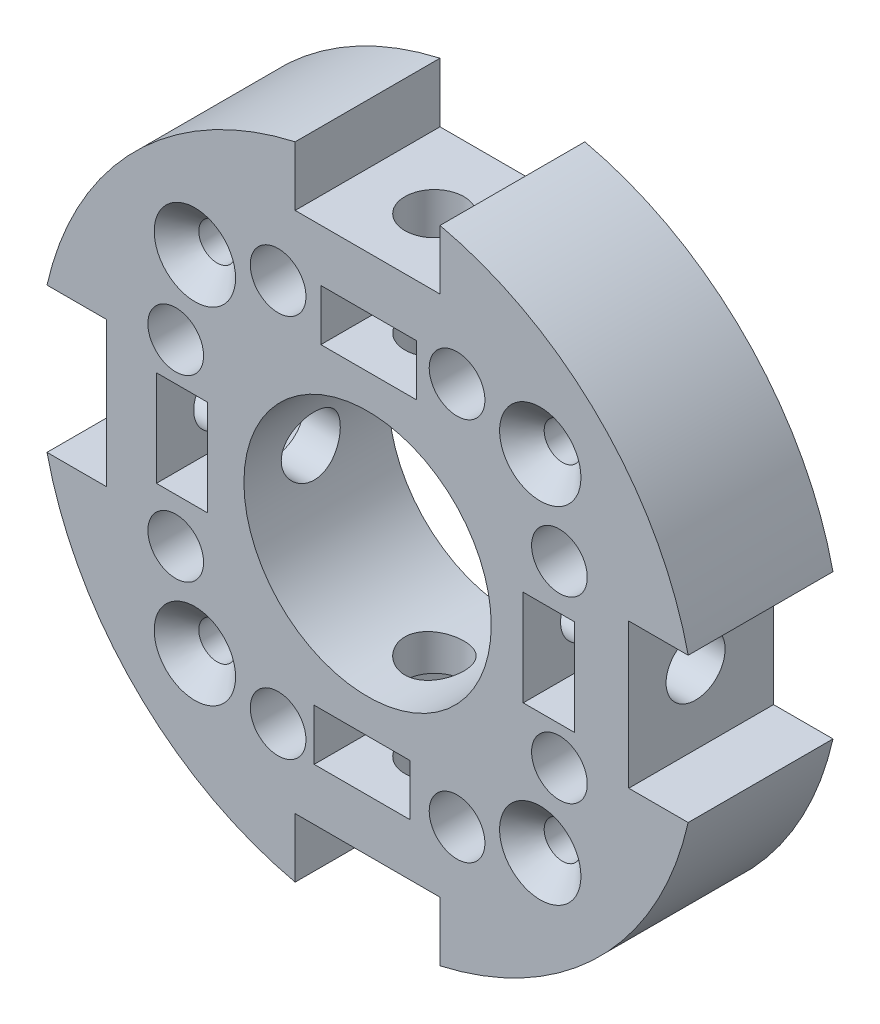
from build123d import *

# Parameters (mm, degrees)
ESQUISSE1_R                         = 11.1
ESQUISSE1_R_2                       = 1.65
ESQUISSE1_R_3                       = 2.5
ESQUISSE1_W                         = 4.6
ESQUISSE1_H                         = 8.6
ESQUISSE1_W_2                       = 8.6
ESQUISSE1_H_2                       = 4.6
BOSS_EXTRU_1_DEPTH                  = 13
CHANFREIN1_SIZE                     = 2
ENL_V_MAT_EXTRU_1_REACH             = 55.454
ESQUISSE2_R                         = 2.65
ENL_V_MAT_EXTRU_1_DIRECTION_2_DEPTH = 54.453675757
R_P_TITION_CIRCULAIRE1_COUNT        = 4


with BuildPart() as part:
    # Esquisse1 → Boss.-Extru.1 (new body)
    with BuildSketch(Plane.XY):
        with BuildLine():
            Line((-23.441352507, -6.5), (-23.441352507, 6.5))
            Line((-23.441352507, 6.5), (-28.77498914, 6.5))
            ThreePointArc((-28.77498914, 6.5), (-20.859650045, 20.859650045), (-6.5, 28.77498914))
            Line((-6.5, 28.77498914), (-6.5, 23.441352507))
            Line((-6.5, 23.441352507), (6.5, 23.441352507))
            Line((6.5, 23.441352507), (6.5, 28.77498914))
            ThreePointArc((6.5, 28.77498914), (20.859650045, 20.859650045), (28.77498914, 6.5))
            Line((28.77498914, 6.5), (23.441352507, 6.5))
            Line((23.441352507, 6.5), (23.441352507, -6.5))
            Line((23.441352507, -6.5), (28.77498914, -6.5))
            ThreePointArc((28.77498914, -6.5), (20.859650045, -20.859650045), (6.5, -28.77498914))
            Line((6.5, -28.77498914), (6.5, -23.441352507))
            Line((6.5, -23.441352507), (-6.5, -23.441352507))
            Line((-6.5, -23.441352507), (-6.5, -28.77498914))
            ThreePointArc((-6.5, -28.77498914), (-20.859650045, -20.859650045), (-28.77498914, -6.5))
            Line((-28.77498914, -6.5), (-23.441352507, -6.5))
        make_face()
        with Locations(Location((0, 0, 0), (0, 0, 180))):
            Circle(ESQUISSE1_R, mode=Mode.SUBTRACT)
        with Locations(Location((-15.5, 15.5, 0), (0, 0, 180))):
            Circle(ESQUISSE1_R_2, mode=Mode.SUBTRACT)
        with Locations(Location((15.5, 15.5, 0), (0, 0, 180))):
            Circle(ESQUISSE1_R_2, mode=Mode.SUBTRACT)
        with Locations(Location((15.5, -15.5, 0), (0, 0, 180))):
            Circle(ESQUISSE1_R_2, mode=Mode.SUBTRACT)
        with Locations(Location((-15.5, -15.5, 0), (0, 0, 180))):
            Circle(ESQUISSE1_R_2, mode=Mode.SUBTRACT)
        with Locations(Location((-8.029746973, 17.219847954, 0), (0, 0, 180))):
            Circle(ESQUISSE1_R_3, mode=Mode.SUBTRACT)
        with Locations(Location((8.029746973, 17.219847954, 0), (0, 0, 180))):
            Circle(ESQUISSE1_R_3, mode=Mode.SUBTRACT)
        with Locations(Location((17.219847954, 8.029746973, 0), (0, 0, 180))):
            Circle(ESQUISSE1_R_3, mode=Mode.SUBTRACT)
        with Locations(Location((17.219847954, -8.029746973, 0), (0, 0, 180))):
            Circle(ESQUISSE1_R_3, mode=Mode.SUBTRACT)
        with Locations(Location((8.029746973, -17.219847954, 0), (0, 0, 180))):
            Circle(ESQUISSE1_R_3, mode=Mode.SUBTRACT)
        with Locations(Location((-8.029746973, -17.219847954, 0), (0, 0, 180))):
            Circle(ESQUISSE1_R_3, mode=Mode.SUBTRACT)
        with Locations(Location((-17.219847954, -8.029746973, 0), (0, 0, 180))):
            Circle(ESQUISSE1_R_3, mode=Mode.SUBTRACT)
        with Locations(Location((-17.219847954, 8.029746973, 0), (0, 0, 180))):
            Circle(ESQUISSE1_R_3, mode=Mode.SUBTRACT)
        with Locations((-16.656153343, 0.3)):
            Rectangle(ESQUISSE1_W, ESQUISSE1_H, mode=Mode.SUBTRACT)
        with Locations((0.106768766, 16.462922109)):
            Rectangle(ESQUISSE1_W_2, ESQUISSE1_H_2, mode=Mode.SUBTRACT)
        with Locations((16.269690876, -0.3)):
            Rectangle(ESQUISSE1_W, ESQUISSE1_H, mode=Mode.SUBTRACT)
        with Locations((-0.493231234, -16.462922109)):
            Rectangle(ESQUISSE1_W_2, ESQUISSE1_H_2, mode=Mode.SUBTRACT)
    extrude(amount=BOSS_EXTRU_1_DEPTH)

    # Chanfrein1
    chanfrein1_edges = [part.edges().sort_by_distance(p)[0] for p in [
        (-13.85, 15.5, 13),
        (17.15, 15.5, 13),
        (17.15, -15.5, 13),
        (-13.85, -15.5, 13),
    ]]
    chamfer(chanfrein1_edges, length=CHANFREIN1_SIZE)

    # Esquisse2 → Enlèv. mat.-Extru.1 (cut, up to next)
    with BuildSketch(Plane.ZY.offset(14.356153343), mode=Mode.PRIVATE) as enl_v_mat_extru_1_sk1:
        with Locations(Location((7, 0, 0), (0, 0, 180))):
            Circle(ESQUISSE2_R)
    enl_v_mat_extru_1_tool1 = extrude(enl_v_mat_extru_1_sk1.sketch, amount=-ENL_V_MAT_EXTRU_1_REACH, mode=Mode.PRIVATE) & part.part
    enl_v_mat_extru_1 = enl_v_mat_extru_1_tool1.solids().sort_by_distance((-14.356153, 0, 7))[0]
    add(enl_v_mat_extru_1, mode=Mode.SUBTRACT)

    # Esquisse2 → Enlèv. mat.-Extru.1 direction 2 (cut)
    with BuildSketch(Plane.ZY.offset(14.356153343)):
        with Locations(Location((7, 0, 0), (0, 0, 180))):
            Circle(ESQUISSE2_R)
    enl_v_mat_extru_1_direction_2 = extrude(amount=ENL_V_MAT_EXTRU_1_DIRECTION_2_DEPTH, mode=Mode.SUBTRACT)

    # Répétition circulaire1: Enlèv. mat.-Extru.1, Enlèv. mat.-Extru.1 direction 2 ×4 about axis
    r_p_tition_circulaire1_axis = Axis((0, 0, 0), (0, 0, -1))
    add([enl_v_mat_extru_1.rotate(r_p_tition_circulaire1_axis, i * 360 / R_P_TITION_CIRCULAIRE1_COUNT) for i in range(1, R_P_TITION_CIRCULAIRE1_COUNT)], mode=Mode.SUBTRACT)
    add([enl_v_mat_extru_1_direction_2.rotate(r_p_tition_circulaire1_axis, i * 360 / R_P_TITION_CIRCULAIRE1_COUNT) for i in range(1, R_P_TITION_CIRCULAIRE1_COUNT)], mode=Mode.SUBTRACT)


solid = part.part
